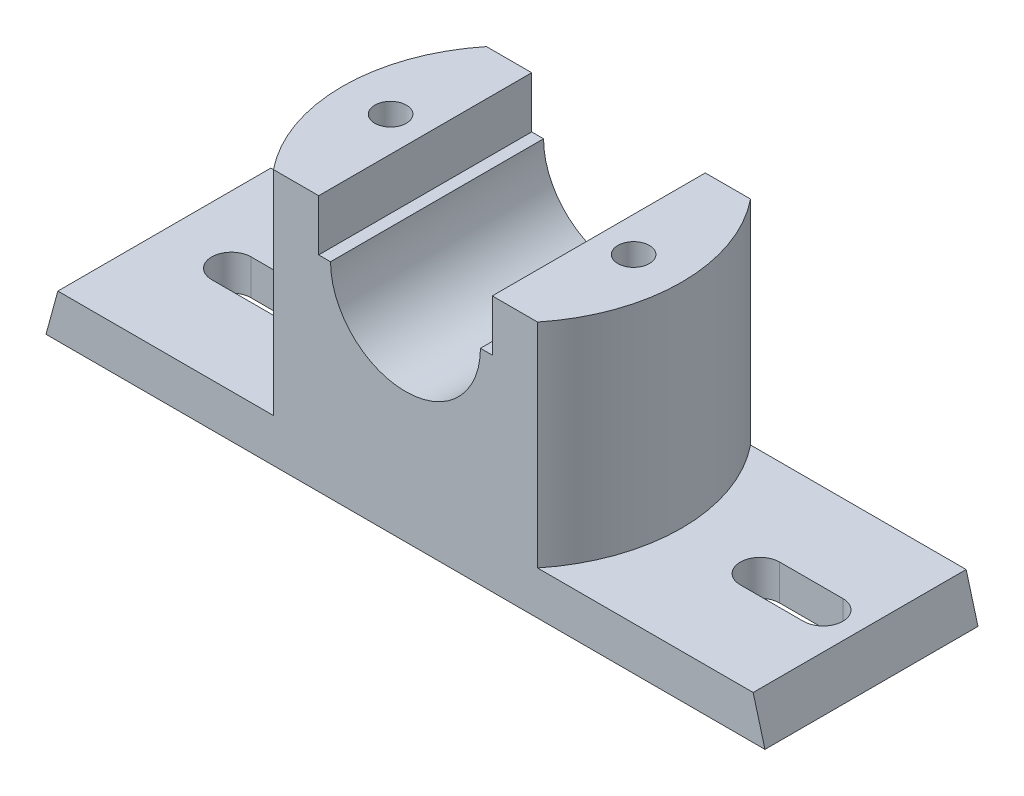
from build123d import *

# Parameters (mm, degrees)
BOSS_EXTRUDE1_DEPTH      = 54
BOSS_EXTRUDE2_DEPTH      = 54
CUT_EXTRUDE4_DEPTH       = 79.958686857
CUT_EXTRUDE8_DEPTH       = 120
CUT_EXTRUDE8_DEPTH_BACK  = 57
SKETCH4_R                = 4
CUT_EXTRUDE10_DEPTH      = 155
CUT_EXTRUDE10_DEPTH_BACK = 93
SKETCH5_R                = 4
CUT_EXTRUDE11_DEPTH      = 155
SKETCH7_W                = 62.578276035
SKETCH7_H                = 34.481752036
SKETCH7_W_2              = 74.024148658
SKETCH7_H_2              = 32.895468992
CUT_EXTRUDE12_DEPTH      = 2


with BuildPart() as part:
    # Sketch1 → Boss-Extrude1 (new body)
    with BuildSketch(Plane.XY):
        Polygon((-95, 0), (87.264140028, 0), (84.264140028, 11), (-92, 11), align=None)
    extrude(amount=BOSS_EXTRUDE1_DEPTH)

    # Sketch2 → Boss-Extrude2 (add)
    with BuildSketch(Plane(origin=(0, 11, 0), x_dir=(1, 0, 0), z_dir=(0, 1, 0))):
        with BuildLine():
            Line((-37.334331048, -54), (29.598471075, -54))
            ThreePointArc((29.598471075, -54), (36.678680511, -41.3168564), (39.132070014, -27))
            ThreePointArc((39.132070014, -27), (36.678680511, -12.6831436), (29.598471075, 0))
            Line((29.598471075, 0), (-37.334331048, 0))
            ThreePointArc((-37.334331048, 0), (-46.867929986, -27), (-37.334331048, -54))
        make_face()
    extrude(amount=BOSS_EXTRUDE2_DEPTH)

    # Sketch3 → Cut-Extrude4 (cut, symmetric)
    with BuildSketch(Plane.XY):
        with BuildLine():
            Line((15.132070014, 52), (18.132070014, 52))
            Line((18.132070014, 52), (18.132070014, 65))
            Line((18.132070014, 65), (-25.867929986, 65))
            Line((-25.867929986, 65), (-25.867929986, 52))
            Line((-25.867929986, 52), (-22.867929986, 52))
            ThreePointArc((-22.867929986, 52), (-3.867929986, 33), (15.132070014, 52))
        make_face()
    extrude(amount=CUT_EXTRUDE4_DEPTH, both=True, mode=Mode.SUBTRACT)

    # Sketch4 → Cut-Extrude8 (cut, two sides: drawn at the far end of the back side and taken through both)
    with BuildSketch(Plane(origin=(0, 0, 0), x_dir=(1, 0, 0), z_dir=(0, 1, 0)).offset(-CUT_EXTRUDE8_DEPTH_BACK)):
        with Locations(Location((-34.646506606, -27, 0), (0, 0, 270))):
            Circle(SKETCH4_R)
    extrude(amount=CUT_EXTRUDE8_DEPTH + CUT_EXTRUDE8_DEPTH_BACK, mode=Mode.SUBTRACT)

    # Sketch5 → Cut-Extrude10 (cut, two sides: drawn at the far end of the back side and taken through both)
    with BuildSketch(Plane(origin=(0, 0, 0), x_dir=(1, 0, 0), z_dir=(0, 1, 0)).offset(-CUT_EXTRUDE10_DEPTH_BACK)):
        with Locations(Location((26.963039677, -27, 0), (0, 0, 270))):
            Circle(SKETCH5_R)
    extrude(amount=CUT_EXTRUDE10_DEPTH + CUT_EXTRUDE10_DEPTH_BACK, mode=Mode.SUBTRACT)

    # Sketch6 → Cut-Extrude11 (cut)
    with BuildSketch(Plane(origin=(0, 11, 0), x_dir=(1, 0, 0), z_dir=(0, 1, 0))):
        with BuildLine():
            Line((75, -32), (59, -32))
            ThreePointArc((59, -32), (54, -27), (59, -22))
            Line((59, -22), (75, -22))
            ThreePointArc((75, -22), (80, -27), (75, -32))
        make_face()
        with BuildLine():
            Line((-59, -32), (-75, -32))
            ThreePointArc((-75, -32), (-80, -27), (-75, -22))
            Line((-75, -22), (-59, -22))
            ThreePointArc((-59, -22), (-54, -27), (-59, -32))
        make_face()
    extrude(amount=-CUT_EXTRUDE11_DEPTH, mode=Mode.SUBTRACT)

    # Sketch7 → Cut-Extrude12 (cut)
    with BuildSketch(Plane.XZ):
        with Locations((-52.436526345, 25.989630072)):
            Rectangle(SKETCH7_W, SKETCH7_H)
        with Locations((46.961370867, 26.782771594)):
            Rectangle(SKETCH7_W_2, SKETCH7_H_2)
    extrude(amount=-CUT_EXTRUDE12_DEPTH, mode=Mode.SUBTRACT)


solid = part.part
